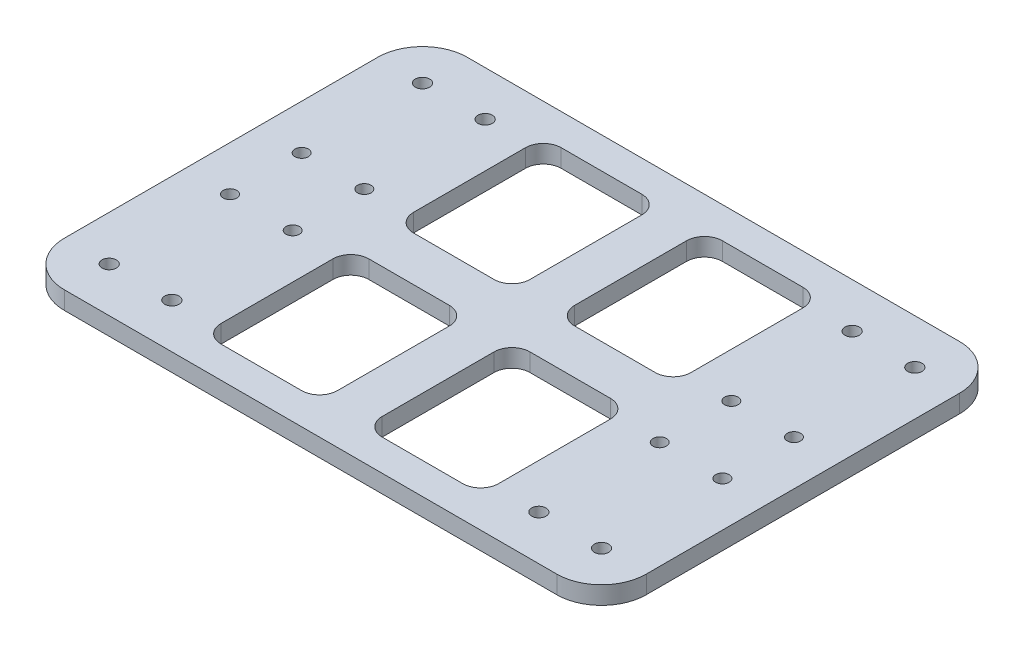
from build123d import *

# Parameters (mm, degrees)
SKETCH2_W           = 130
SKETCH2_H           = 90
BOSS_EXTRUDE1_DEPTH = 4
SKETCH3_R           = 1.5
CUT_EXTRUDE1_DEPTH  = 10
SKETCH4_R           = 1.6
CUT_EXTRUDE2_DEPTH  = 10
FILLET1_R           = 10
CUT_EXTRUDE3_DEPTH  = 10


with BuildPart() as part:
    # Sketch2 → Boss-Extrude1 (new body)
    with BuildSketch(Plane(origin=(0, 0, 0), x_dir=(1, 0, 0), z_dir=(0, 1, 0))):
        with Locations((71.271186441, 55.564971751)):
            Rectangle(SKETCH2_W, SKETCH2_H)
    extrude(amount=-BOSS_EXTRUDE1_DEPTH)

    # Sketch3 → Cut-Extrude1 (cut)
    with BuildSketch(Plane(origin=(0, 0, 0), x_dir=(1, 0, 0), z_dir=(0, 1, 0))):
        with Locations(Location((126.271186441, 63.564971751, 0), (0, 0, 270))):
            Circle(SKETCH3_R)
        with Locations(Location((126.271186441, 47.564971751, 0), (0, 0, 270))):
            Circle(SKETCH3_R)
        with Locations(Location((112.271186441, 47.564971751, 0), (0, 0, 270))):
            Circle(SKETCH3_R)
        with Locations(Location((112.271186441, 63.564971751, 0), (0, 0, 270))):
            Circle(SKETCH3_R)
        with Locations(Location((16.271186441, 47.564971751, 0), (0, 0, 90))):
            Circle(SKETCH3_R)
        with Locations(Location((30.271186441, 47.564971751, 0), (0, 0, 90))):
            Circle(SKETCH3_R)
        with Locations(Location((16.271186441, 63.564971751, 0), (0, 0, 90))):
            Circle(SKETCH3_R)
        with Locations(Location((30.271186441, 63.564971751, 0), (0, 0, 90))):
            Circle(SKETCH3_R)
    extrude(amount=-CUT_EXTRUDE1_DEPTH, mode=Mode.SUBTRACT)

    # Sketch4 → Cut-Extrude2 (cut)
    with BuildSketch(Plane(origin=(0, 0, 0), x_dir=(1, 0, 0), z_dir=(0, 1, 0))):
        with Locations(Location((16.271186441, 20.564971751, 0), (0, 0, 270))):
            Circle(SKETCH4_R)
        with Locations(Location((30.271186441, 20.564971751, 0), (0, 0, 270))):
            Circle(SKETCH4_R)
        with Locations(Location((30.271186441, 90.564971751, 0), (0, 0, 90))):
            Circle(SKETCH4_R)
        with Locations(Location((16.271186441, 90.564971751, 0), (0, 0, 90))):
            Circle(SKETCH4_R)
        with Locations(Location((112.271186441, 20.564971751, 0), (0, 0, 90))):
            Circle(SKETCH4_R)
        with Locations(Location((126.271186441, 20.564971751, 0), (0, 0, 90))):
            Circle(SKETCH4_R)
        with Locations(Location((126.271186441, 90.564971751, 0), (0, 0, 270))):
            Circle(SKETCH4_R)
        with Locations(Location((112.271186441, 90.564971751, 0), (0, 0, 270))):
            Circle(SKETCH4_R)
    extrude(amount=-CUT_EXTRUDE2_DEPTH, mode=Mode.SUBTRACT)

    # Fillet1
    fillet1_edges = [part.edges().sort_by_distance(p)[0] for p in [
        (6.271186441, -2, -100.564971751),
        (136.271186441, -2, -100.564971751),
        (136.271186441, -2, -10.564971751),
        (6.271186441, -2, -10.564971751),
    ]]
    fillet(fillet1_edges, radius=FILLET1_R)

    # Sketch5 → Cut-Extrude3 (cut)
    with BuildSketch(Plane(origin=(0, 0, 0), x_dir=(1, 0, 0), z_dir=(0, 1, 0))):
        with BuildLine():
            Line((76.271186441, 89.564971751), (76.271186441, 64.564971751))
            ThreePointArc((76.271186441, 64.564971751), (77.442759316, 61.736544627), (80.271186441, 60.564971751))
            Line((80.271186441, 60.564971751), (98.271186441, 60.564971751))
            ThreePointArc((98.271186441, 60.564971751), (101.099613565, 61.736544627), (102.271186441, 64.564971751))
            Line((102.271186441, 64.564971751), (102.271186441, 89.564971751))
            ThreePointArc((102.271186441, 89.564971751), (101.099613565, 92.393398876), (98.271186441, 93.564971751))
            Line((98.271186441, 93.564971751), (80.271186441, 93.564971751))
            ThreePointArc((80.271186441, 93.564971751), (77.442759316, 92.393398876), (76.271186441, 89.564971751))
        make_face()
        with BuildLine():
            Line((40.271186441, 89.564971751), (40.271186441, 64.564971751))
            ThreePointArc((40.271186441, 64.564971751), (41.442759316, 61.736544627), (44.271186441, 60.564971751))
            Line((44.271186441, 60.564971751), (62.271186441, 60.564971751))
            ThreePointArc((62.271186441, 60.564971751), (65.099613565, 61.736544627), (66.271186441, 64.564971751))
            Line((66.271186441, 64.564971751), (66.271186441, 89.564971751))
            ThreePointArc((66.271186441, 89.564971751), (65.099613565, 92.393398876), (62.271186441, 93.564971751))
            Line((62.271186441, 93.564971751), (44.271186441, 93.564971751))
            ThreePointArc((44.271186441, 93.564971751), (41.442759316, 92.393398876), (40.271186441, 89.564971751))
        make_face()
        with BuildLine():
            Line((66.271186441, 21.564971751), (66.271186441, 46.564971751))
            ThreePointArc((66.271186441, 46.564971751), (65.099613565, 49.393398876), (62.271186441, 50.564971751))
            Line((62.271186441, 50.564971751), (44.271186441, 50.564971751))
            ThreePointArc((44.271186441, 50.564971751), (41.442759316, 49.393398876), (40.271186441, 46.564971751))
            Line((40.271186441, 46.564971751), (40.271186441, 21.564971751))
            ThreePointArc((40.271186441, 21.564971751), (41.442759316, 18.736544627), (44.271186441, 17.564971751))
            Line((44.271186441, 17.564971751), (62.271186441, 17.564971751))
            ThreePointArc((62.271186441, 17.564971751), (65.099613565, 18.736544627), (66.271186441, 21.564971751))
        make_face()
        with BuildLine():
            Line((102.271186441, 21.564971751), (102.271186441, 46.564971751))
            ThreePointArc((102.271186441, 46.564971751), (101.099613565, 49.393398876), (98.271186441, 50.564971751))
            Line((98.271186441, 50.564971751), (80.271186441, 50.564971751))
            ThreePointArc((80.271186441, 50.564971751), (77.442759316, 49.393398876), (76.271186441, 46.564971751))
            Line((76.271186441, 46.564971751), (76.271186441, 21.564971751))
            ThreePointArc((76.271186441, 21.564971751), (77.442759316, 18.736544627), (80.271186441, 17.564971751))
            Line((80.271186441, 17.564971751), (98.271186441, 17.564971751))
            ThreePointArc((98.271186441, 17.564971751), (101.099613565, 18.736544627), (102.271186441, 21.564971751))
        make_face()
    extrude(amount=-CUT_EXTRUDE3_DEPTH, mode=Mode.SUBTRACT)


solid = part.part
